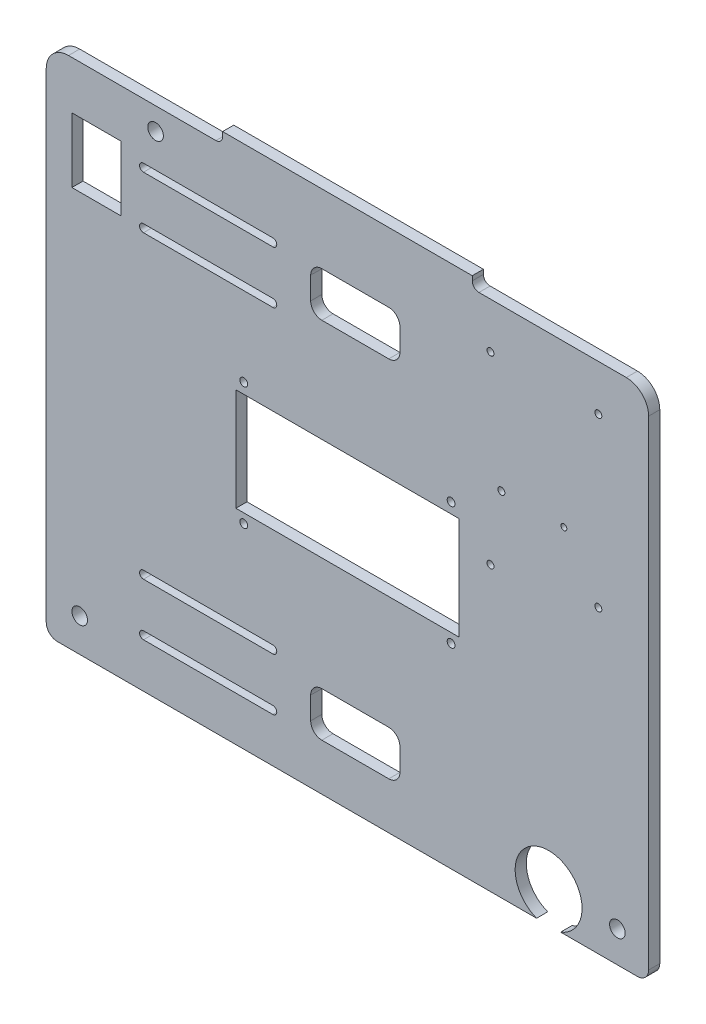
from build123d import *

# Parameters (mm, degrees)
SKETCH1_W           = 270
SKETCH1_H           = 260
BOSS_EXTRUDE1_DEPTH = 5
SKETCH2_R           = 3.5
CUT_EXTRUDE1_DEPTH  = 188.483332593
SKETCH3_R           = 15
CUT_EXTRUDE2_DEPTH  = 188.483332593
FILLET1_R           = 5
CUT_EXTRUDE3_DEPTH  = 188.483332593
SKETCH6_W           = 111.9
SKETCH6_H           = 5
BOSS_EXTRUDE2_DEPTH = 5
FILLET2_R           = 10
SKETCH9_W           = 22
SKETCH9_H           = 29
CUT_EXTRUDE5_DEPTH  = 188.483332593
SKETCH10_R          = 1.75
CUT_EXTRUDE6_DEPTH  = 188.483332593
SKETCH11_W          = 100
SKETCH11_H          = 46
CUT_EXTRUDE7_DEPTH  = 188.483332593
SKETCH12_R          = 1.5621
SKETCH12_R_2        = 1.315256363
CUT_EXTRUDE8_DEPTH  = 188.483332593
SKETCH13_W          = 40
SKETCH13_H          = 20
CUT_EXTRUDE9_DEPTH  = 188.483332593
FILLET3_R           = 3
FILLET6_R           = 5
FILLET7_R           = 5


with BuildPart() as part:
    # Sketch1 → Boss-Extrude1 (new body)
    with BuildSketch(Plane.XY):
        Rectangle(SKETCH1_W, SKETCH1_H)
    extrude(amount=BOSS_EXTRUDE1_DEPTH)

    # Sketch2 → Cut-Extrude1 (cut, through all)
    with BuildSketch(Plane(origin=(0, 0, 0), x_dir=(-1, 0, 0), z_dir=(0, 0, -1))):
        with Locations((120, -115)):
            Circle(SKETCH2_R)
        with Locations((86, 90)):
            Circle(SKETCH2_R)
        with Locations((-121, -116)):
            Circle(SKETCH2_R)
    extrude(amount=-CUT_EXTRUDE1_DEPTH, mode=Mode.SUBTRACT)

    # Sketch3 → Cut-Extrude2 (cut, through all)
    with BuildSketch(Plane.XY.offset(5)):
        with Locations((90.172367877, -116)):
            Circle(SKETCH3_R)
    extrude(amount=-CUT_EXTRUDE2_DEPTH, mode=Mode.SUBTRACT)

    # Fillet1
    fillet1_edges = [part.edges().sort_by_distance(p)[0] for p in [
        (135, -130, 2.5),
        (-135, -130, 2.5),
        (-135, 130, 2.5),
        (135, 130, 2.5),
    ]]
    fillet(fillet1_edges, radius=FILLET1_R)

    # Sketch4 → Cut-Extrude3 (cut, through all)
    with BuildSketch(Plane(origin=(0, 0, 0), x_dir=(-1, 0, 0), z_dir=(0, 0, -1))):
        with BuildLine():
            Line((95.6, 100), (135, 100))
            Line((135, 100), (135, 125))
            ThreePointArc((135, 125), (133.535533906, 128.535533906), (130, 130))
            Line((130, 130), (-130, 130))
            ThreePointArc((-130, 130), (-133.535533906, 128.535533906), (-135, 125))
            Line((-135, 125), (-135, 100))
            Line((-135, 100), (90.2, 100))
            Line((90.2, 100), (95.6, 100))
        make_face()
    extrude(amount=-CUT_EXTRUDE3_DEPTH, mode=Mode.SUBTRACT)

    # Sketch6 → Boss-Extrude2 (add)
    with BuildSketch(Plane.XY.offset(5)):
        with Locations((0, 102.5)):
            Rectangle(SKETCH6_W, SKETCH6_H)
    extrude(amount=-BOSS_EXTRUDE2_DEPTH)

    # Fillet2
    fillet2_edges = [part.edges().sort_by_distance(p)[0] for p in [
        (-135, 100, 2.5),
        (135, 100, 2.5),
    ]]
    fillet(fillet2_edges, radius=FILLET2_R)

    # Sketch9 → Cut-Extrude5 (cut, through all)
    with BuildSketch(Plane.XY.offset(5)):
        with Locations((-112.5, 64)):
            Rectangle(SKETCH9_W, SKETCH9_H)
    extrude(amount=-CUT_EXTRUDE5_DEPTH, mode=Mode.SUBTRACT)

    # Sketch10 → Cut-Extrude6 (cut, through all)
    with BuildSketch(Plane(origin=(0, 0, 0), x_dir=(-1, 0, 0), z_dir=(0, 0, -1))):
        with Locations((-46.46, 12.46)):
            Circle(SKETCH10_R)
        with Locations((46.46, 12.46)):
            Circle(SKETCH10_R)
        with Locations((-46.46, -42.46)):
            Circle(SKETCH10_R)
        with Locations((46.46, -42.46)):
            Circle(SKETCH10_R)
    extrude(amount=-CUT_EXTRUDE6_DEPTH, mode=Mode.SUBTRACT)

    # Sketch11 → Cut-Extrude7 (cut, through all)
    with BuildSketch(Plane.XY.offset(5)):
        with Locations((0, -15.253546855)):
            Rectangle(SKETCH11_W, SKETCH11_H)
    extrude(amount=-CUT_EXTRUDE7_DEPTH, mode=Mode.SUBTRACT)

    # Sketch12 → Cut-Extrude8 (cut, through all)
    with BuildSketch(Plane.XY.offset(5)):
        with Locations((112.46, 4.3944)):
            Circle(SKETCH12_R)
        with Locations((64.1238, -3.0986)):
            Circle(SKETCH12_R)
        with Locations((69.002292766, 27.9021)):
            Circle(SKETCH12_R)
        with Locations((97.018492766, 27.9021)):
            Circle(SKETCH12_R_2)
        with Locations((112.46, 79.5276)):
            Circle(SKETCH12_R)
        with Locations((64.1238, 79.5276)):
            Circle(SKETCH12_R)
    extrude(amount=-CUT_EXTRUDE8_DEPTH, mode=Mode.SUBTRACT)

    # Sketch13 → Cut-Extrude9 (cut, through all)
    with BuildSketch(Plane(origin=(0, 0, 0), x_dir=(-1, 0, 0), z_dir=(0, 0, -1))):
        with BuildLine():
            Line((33.41898198, 75), (91.408776107, 75))
            ThreePointArc((91.408776107, 75), (93.158776107, 73.25), (91.408776107, 71.5))
            Line((91.408776107, 71.5), (33.41898198, 71.5))
            ThreePointArc((33.41898198, 71.5), (31.66898198, 73.25), (33.41898198, 75))
        make_face()
        with BuildLine():
            Line((33.41898198, 51.5), (91.408776107, 51.5))
            ThreePointArc((91.408776107, 51.5), (93.158776107, 49.75), (91.408776107, 48))
            Line((91.408776107, 48), (33.41898198, 48))
            ThreePointArc((33.41898198, 48), (31.66898198, 49.75), (33.41898198, 51.5))
        make_face()
        with Locations((-3.530791298, 64)):
            Rectangle(SKETCH13_W, SKETCH13_H)
        with Locations((-3.530791298, -99)):
            Rectangle(SKETCH13_W, SKETCH13_H)
        with BuildLine():
            Line((33.41898198, -86.5), (91.408776107, -86.5))
            ThreePointArc((91.408776107, -86.5), (93.158776107, -84.75), (91.408776107, -83))
            Line((91.408776107, -83), (33.41898198, -83))
            ThreePointArc((33.41898198, -83), (31.66898198, -84.75), (33.41898198, -86.5))
        make_face()
        with BuildLine():
            Line((33.41898198, -110), (91.408776107, -110))
            ThreePointArc((91.408776107, -110), (93.158776107, -108.25), (91.408776107, -106.5))
            Line((91.408776107, -106.5), (33.41898198, -106.5))
            ThreePointArc((33.41898198, -106.5), (31.66898198, -108.25), (33.41898198, -110))
        make_face()
    extrude(amount=-CUT_EXTRUDE9_DEPTH, mode=Mode.SUBTRACT)

    # Fillet3
    fillet3_edges = [part.edges().sort_by_distance(p)[0] for p in [
        (-55.95, 100, 2.5),
        (55.95, 100, 2.5),
    ]]
    fillet(fillet3_edges, radius=FILLET3_R)

    # Fillet6
    fillet6_edges = [part.edges().sort_by_distance(p)[0] for p in [
        (-16.469208702, 74, 2.5),
        (-16.469208702, 54, 2.5),
        (23.530791298, 54, 2.5),
        (23.530791298, 74, 2.5),
    ]]
    fillet(fillet6_edges, radius=FILLET6_R)

    # Fillet7
    fillet7_edges = [part.edges().sort_by_distance(p)[0] for p in [
        (23.530791298, -109, 2.5),
        (23.530791298, -89, 2.5),
        (-16.469208702, -89, 2.5),
        (-16.469208702, -109, 2.5),
    ]]
    fillet(fillet7_edges, radius=FILLET7_R)


solid = part.part
